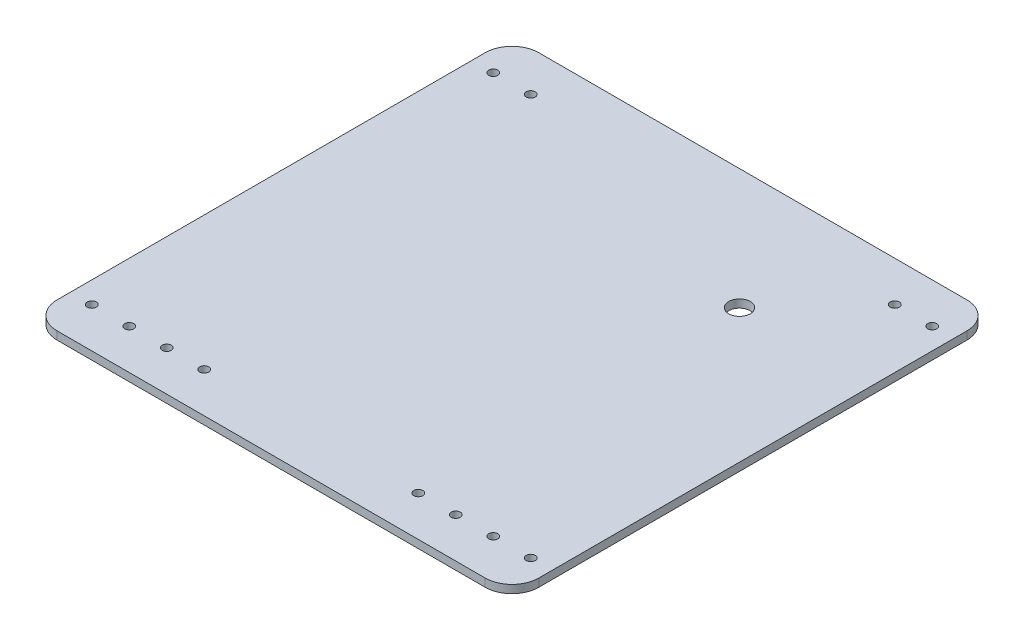
from build123d import *

# Parameters (mm, degrees)
SKETCH1_W           = 180
SKETCH1_H           = 180
BOSS_EXTRUDE1_DEPTH = 3
FILLET1_R           = 10
SKETCH2_R           = 1.7
CUT_EXTRUDE1_DEPTH  = 3
SKETCH3_R           = 4
CUT_EXTRUDE2_DEPTH  = 128.314571044


with BuildPart() as part:
    # Sketch1 → Boss-Extrude1 (new body)
    with BuildSketch(Plane(origin=(0, 0, 0), x_dir=(1, 0, 0), z_dir=(0, 1, 0))):
        Rectangle(SKETCH1_W, SKETCH1_H)
    extrude(amount=BOSS_EXTRUDE1_DEPTH)

    # Fillet1
    fillet1_edges = [part.edges().sort_by_distance(p)[0] for p in [
        (90, 1.5, 90),
        (-90, 1.5, 90),
        (-90, 1.5, -90),
        (90, 1.5, -90),
    ]]
    fillet(fillet1_edges, radius=FILLET1_R)

    # Sketch2 → Cut-Extrude1 (cut)
    with BuildSketch(Plane(origin=(0, 3, 0), x_dir=(1, 0, 0), z_dir=(0, 1, 0))):
        with Locations(Location((-82, 75, 0), (0, 0, 270))):
            Circle(SKETCH2_R)
        with Locations(Location((-68, 75, 0), (0, 0, 270))):
            Circle(SKETCH2_R)
        with Locations(Location((68, 75, 0), (0, 0, 270))):
            Circle(SKETCH2_R)
        with Locations(Location((82, 75, 0), (0, 0, 270))):
            Circle(SKETCH2_R)
        with Locations(Location((-82, -75, 0), (0, 0, 270))):
            Circle(SKETCH2_R)
        with Locations(Location((-68, -75, 0), (0, 0, 270))):
            Circle(SKETCH2_R)
        with Locations(Location((68, -75, 0), (0, 0, 270))):
            Circle(SKETCH2_R)
        with Locations(Location((82, -75, 0), (0, 0, 270))):
            Circle(SKETCH2_R)
        with Locations(Location((-54, -75, 0), (0, 0, 270))):
            Circle(SKETCH2_R)
        with Locations(Location((54, -75, 0), (0, 0, 270))):
            Circle(SKETCH2_R)
        with Locations(Location((-40, -75, 0), (0, 0, 270))):
            Circle(SKETCH2_R)
        with Locations(Location((40, -75, 0), (0, 0, 270))):
            Circle(SKETCH2_R)
    extrude(amount=-CUT_EXTRUDE1_DEPTH, mode=Mode.SUBTRACT)

    # Sketch3 → Cut-Extrude2 (cut, through all)
    with BuildSketch(Plane(origin=(0, 3, 0), x_dir=(1, 0, 0), z_dir=(0, 1, 0))):
        with Locations(Location((40, 45, 0), (0, 0, 270))):
            Circle(SKETCH3_R)
    extrude(amount=-CUT_EXTRUDE2_DEPTH, mode=Mode.SUBTRACT)


solid = part.part
